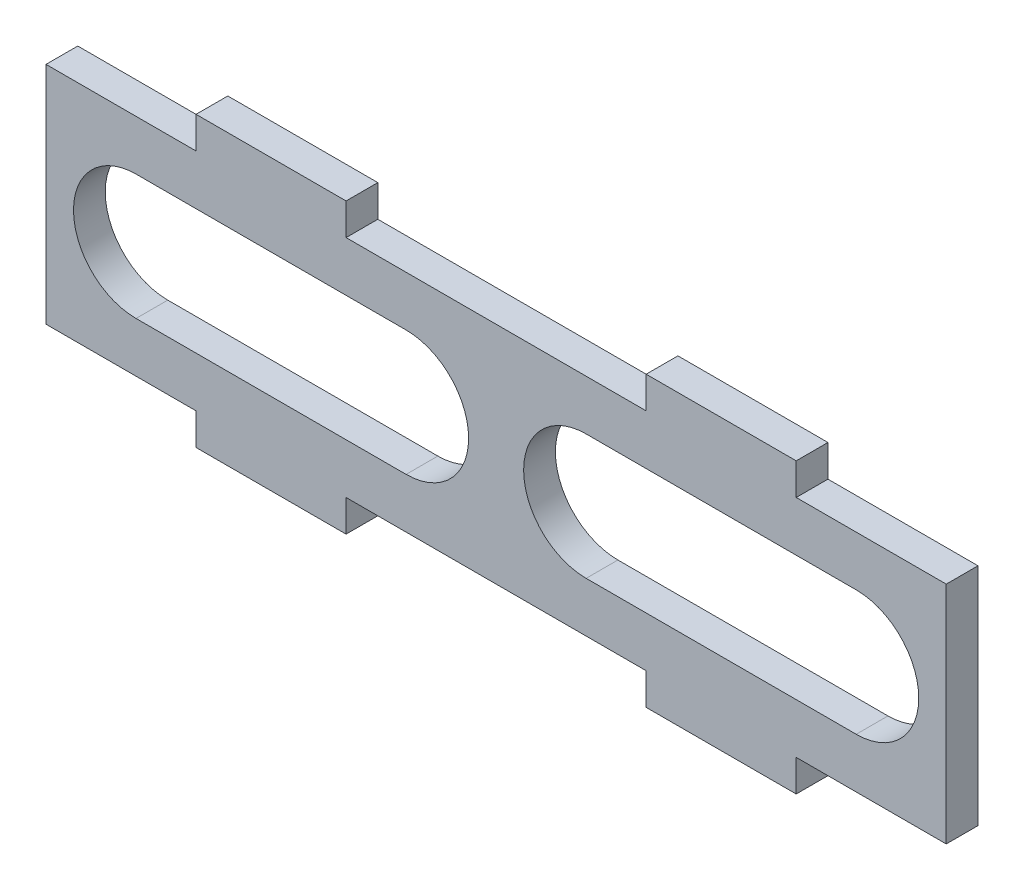
from build123d import *

# Parameters (mm, degrees)
ESQUISSE1_W             = 180
ESQUISSE1_H             = 45
BOSS_EXTRU_1_DEPTH      = 6.35
ENL_V_MAT_EXTRU_1_REACH = 102.823
ESQUISSE3_W             = 30
ESQUISSE3_H             = 6.35
BOSS_EXTRU_2_DEPTH      = 6.35


with BuildPart() as part:
    # Esquisse1 → Boss.-Extru.1 (new body)
    with BuildSketch(Plane.XY):
        with Locations((0, 22.5)):
            Rectangle(ESQUISSE1_W, ESQUISSE1_H)
    extrude(amount=BOSS_EXTRU_1_DEPTH)

    # Esquisse2 → Enlèv. mat.-Extru.1 (cut, up to next)
    with BuildSketch(Plane.XY.offset(6.35), mode=Mode.PRIVATE) as enl_v_mat_extru_1_sk1:
        with BuildLine():
            Line((-72, 35), (-18, 35))
            ThreePointArc((-18, 35), (-5.5, 22.5), (-18, 10))
            Line((-18, 10), (-72, 10))
            ThreePointArc((-72, 10), (-84.5, 22.5), (-72, 35))
        make_face()
    enl_v_mat_extru_1_tool1 = extrude(enl_v_mat_extru_1_sk1.sketch, amount=-ENL_V_MAT_EXTRU_1_REACH, mode=Mode.PRIVATE) & part.part
    # Esquisse2 → Enlèv. mat.-Extru.1 (cut, up to next)
    with BuildSketch(Plane.XY.offset(6.35), mode=Mode.PRIVATE) as enl_v_mat_extru_1_sk2:
        with BuildLine():
            Line((72, 35), (18, 35))
            ThreePointArc((18, 35), (5.5, 22.5), (18, 10))
            Line((18, 10), (72, 10))
            ThreePointArc((72, 10), (84.5, 22.5), (72, 35))
        make_face()
    enl_v_mat_extru_1_tool2 = extrude(enl_v_mat_extru_1_sk2.sketch, amount=-ENL_V_MAT_EXTRU_1_REACH, mode=Mode.PRIVATE) & part.part
    add(enl_v_mat_extru_1_tool1.solids().sort_by_distance((-45, 22.5, 6.35))[0], mode=Mode.SUBTRACT)
    add(enl_v_mat_extru_1_tool2.solids().sort_by_distance((45, 22.5, 6.35))[0], mode=Mode.SUBTRACT)

    # Esquisse3 → Boss.-Extru.2 (add)
    with BuildSketch(Plane.XY.offset(6.35)):
        with Locations((-45, 48.175)):
            Rectangle(ESQUISSE3_W, ESQUISSE3_H)
        with Locations((-45, -3.175)):
            Rectangle(ESQUISSE3_W, ESQUISSE3_H)
        with Locations((45, -3.175)):
            Rectangle(ESQUISSE3_W, ESQUISSE3_H)
        with Locations((45, 48.175)):
            Rectangle(ESQUISSE3_W, ESQUISSE3_H)
    extrude(amount=-BOSS_EXTRU_2_DEPTH)


solid = part.part
